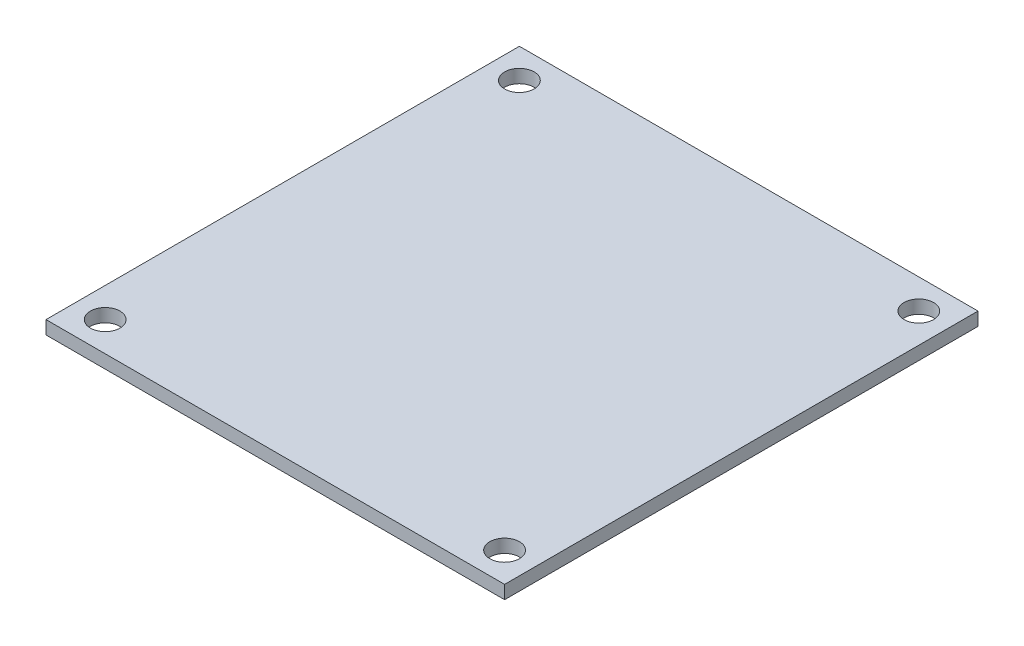
from build123d import *

# Parameters (mm, degrees)
SKETCH1_W           = 31
SKETCH1_H           = 32
BOSS_EXTRUDE1_DEPTH = 0.9
SKETCH2_R           = 1
CUT_EXTRUDE1_DEPTH  = 45.562428121


with BuildPart() as part:
    # Sketch1 → Boss-Extrude1 (new body)
    with BuildSketch(Plane(origin=(0, 0, 0), x_dir=(1, 0, 0), z_dir=(0, 1, 0))):
        with Locations((15.5, 16)):
            Rectangle(SKETCH1_W, SKETCH1_H)
    extrude(amount=BOSS_EXTRUDE1_DEPTH)

    # Sketch2 → Cut-Extrude1 (cut, through all)
    with BuildSketch(Plane(origin=(0, 0.9, 0), x_dir=(1, 0, 0), z_dir=(0, 1, 0))):
        with Locations(Location((2, 30, 0), (0, 0, 270))):
            Circle(SKETCH2_R)
        with Locations(Location((29, 30, 0), (0, 0, 270))):
            Circle(SKETCH2_R)
        with Locations(Location((29, 2, 0), (0, 0, 270))):
            Circle(SKETCH2_R)
        with Locations(Location((2, 2, 0), (0, 0, 270))):
            Circle(SKETCH2_R)
    extrude(amount=-CUT_EXTRUDE1_DEPTH, mode=Mode.SUBTRACT)


solid = part.part
